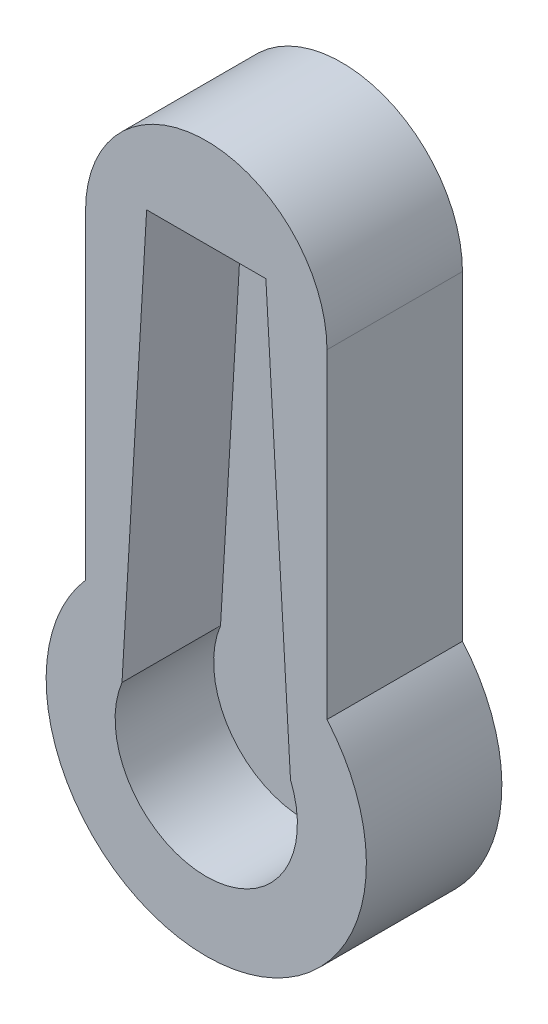
from build123d import *
from build123d.topology import SkipClean

# Parameters (mm, degrees)
BOSS_EXTRUDE1_DEPTH = 4
BOSS_EXTRUDE2_START = 1.5
BOSS_EXTRUDE2_DEPTH = 1.5


with BuildPart() as part:
    # Sketch2 → Boss-Extrude1 (new body)
    with BuildSketch(Plane.XY):
        with BuildLine():
            Line((-4.9, 4.270831301), (-4.9, 17.270831301))
            ThreePointArc((-4.9, 17.270831301), (0, 22.170831301), (4.9, 17.270831301))
            Line((4.9, 17.270831301), (4.9, 4.270831301))
            ThreePointArc((4.9, 4.270831301), (0, -6.5), (-4.9, 4.270831301))
        make_face()
        with BuildLine():
            Line((2.42, 18.53), (-2.42, 18.53))
            Line((-2.42, 18.53), (-3.42, 1.411949008))
            ThreePointArc((-3.42, 1.411949008), (0, -3.7), (3.42, 1.411949008))
            Line((3.42, 1.411949008), (2.42, 18.53))
        make_face(mode=Mode.SUBTRACT)
    extrude(amount=BOSS_EXTRUDE1_DEPTH)

    # Sketch3 → Boss-Extrude2 (add)
    with SkipClean():  # the faces are left unmerged after this step: merging them gives an invalid solid
        with BuildSketch(Plane(origin=(0, 0, 0), x_dir=(-1, 0, 0), z_dir=(0, 0, -1)).offset(BOSS_EXTRUDE2_START)):
            with BuildLine():
                Line((-4.9, 4.270831301), (-4.9, 17.270831301))
                ThreePointArc((-4.9, 17.270831301), (0, 22.170831301), (4.9, 17.270831301))
                Line((4.9, 17.270831301), (4.9, 4.270831301))
                ThreePointArc((4.9, 4.270831301), (0, -6.5), (-4.9, 4.270831301))
            make_face()
        extrude(amount=-BOSS_EXTRUDE2_DEPTH)


solid = part.part
